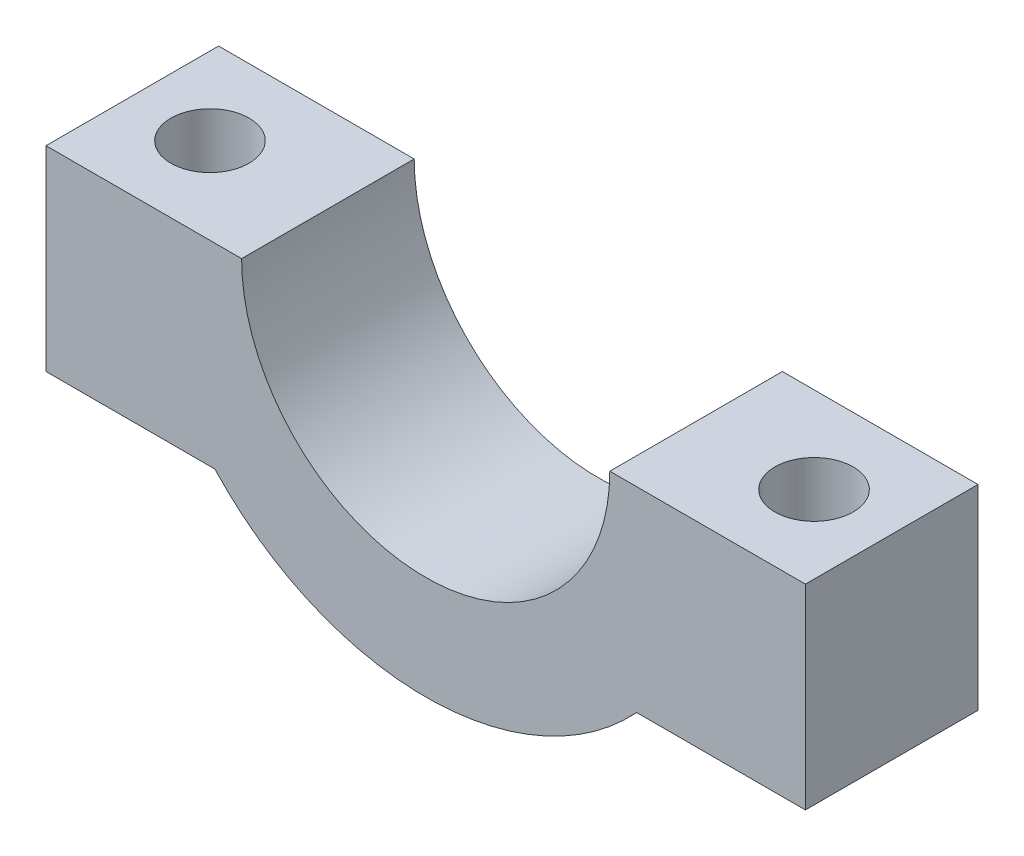
from build123d import *

# Parameters (mm, degrees)
BOSS_EXTRUDE1_DEPTH      = 7.5
BOSS_EXTRUDE1_DEPTH_BACK = 7.5
TAP_DRILL_FOR_M8_TAP1_D  = 6.8


with BuildPart() as part:
    # Sketch1 → Boss-Extrude1 (new, two sides: drawn at the far end of the back side and taken through both)
    with BuildSketch(Plane.XY.offset(-BOSS_EXTRUDE1_DEPTH_BACK)):
        with BuildLine():
            Line((-33, 0), (-16, 0))
            ThreePointArc((-16, 0), (0, -16), (16, 0))
            Line((16, 0), (33, 0))
            Line((33, 0), (33, -17))
            Line((33, -17), (18.33030278, -17))
            ThreePointArc((18.33030278, -17), (0, -25), (-18.33030278, -17))
            Line((-18.33030278, -17), (-33, -17))
            Line((-33, -17), (-33, 0))
        make_face()
    extrude(amount=BOSS_EXTRUDE1_DEPTH + BOSS_EXTRUDE1_DEPTH_BACK)

    # Tap Drill for M8 Tap1 (through all)
    with Locations(Plane(origin=(0, -17, 0), x_dir=(-1, 0, 0), z_dir=(0, -1, 0))):
        with Locations((26.25, 0), (-26.25, 0)):
            Hole(TAP_DRILL_FOR_M8_TAP1_D / 2)


solid = part.part
